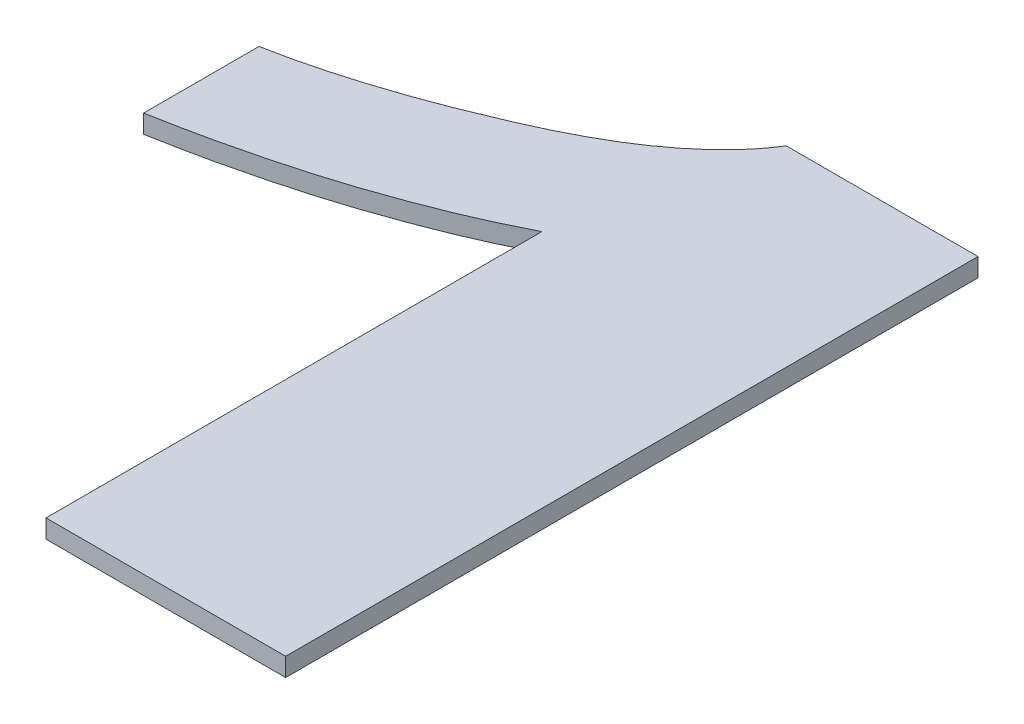
from build123d import *

# Parameters (mm, degrees)
SALIENTE_EXTRUIR1_DEPTH = 0.8


with BuildPart() as part:
    # Croquis1 → Saliente-Extruir1 (new body)
    with BuildSketch(Plane(origin=(0, 0, 0), x_dir=(1, 0, 0), z_dir=(0, 1, 0))):
        with BuildLine():
            Line((11.951198341, 0), (1.566582957, 0))
            Line((1.566582957, 0), (1.566582957, 21.484375))
            add(Edge.make_bspline(
                [(1.566582957, 21.484375), (1.095820528, 21.251760804), (0.143924465, 20.781407768), (-1.339162826, 20.146101999), (-2.883063991, 19.561156582), (-4.486453246, 19.009201316), (-6.153702842, 18.514537388), (-7.88399318, 18.064343747), (-9.672785077, 17.652551437), (-10.892485897, 17.42364675), (-11.51034012, 17.307692308)],
                knots=[0, 0, 0, 0, 0.914662506, 1.849475632, 2.80936432, 3.790486333, 4.802984391, 5.838208378, 6.90491827, 8, 8, 8, 8], degree=3))
            Line((-11.51034012, 17.307692308), (-11.51034012, 22.307692308))
            add(Edge.make_bspline(
                [(-11.51034012, 22.307692308), (-11.171106186, 22.372634387), (-10.483453335, 22.504276895), (-9.451668755, 22.763592481), (-8.39369247, 23.049455415), (-7.317476662, 23.388764811), (-6.216247699, 23.760045556), (-5.09514427, 24.174939392), (-3.956405837, 24.642192089), (-2.804458982, 25.127837698), (-1.691104507, 25.65221946), (-0.654736292, 26.206690566), (0.295578873, 26.774589611), (1.147842659, 27.377323684), (1.915075329, 27.993311535), (2.586248834, 28.63448494), (3.172747888, 29.2922732), (3.490689658, 29.767831075), (3.64590988, 30)],
                knots=[0, 0, 0, 0, 0.954535859, 1.934916405, 2.939715041, 3.983531249, 5.053414062, 6.151915828, 7.287094686, 8.455495175, 9.607244907, 10.687324305, 11.703425869, 12.665113946, 13.570542581, 14.420407214, 15.228837587, 16, 16, 16, 16], degree=3))
            Line((3.64590988, 30), (11.951198341, 30))
            Line((11.951198341, 30), (11.951198341, 0))
        make_face()
    extrude(amount=SALIENTE_EXTRUIR1_DEPTH)


solid = part.part
